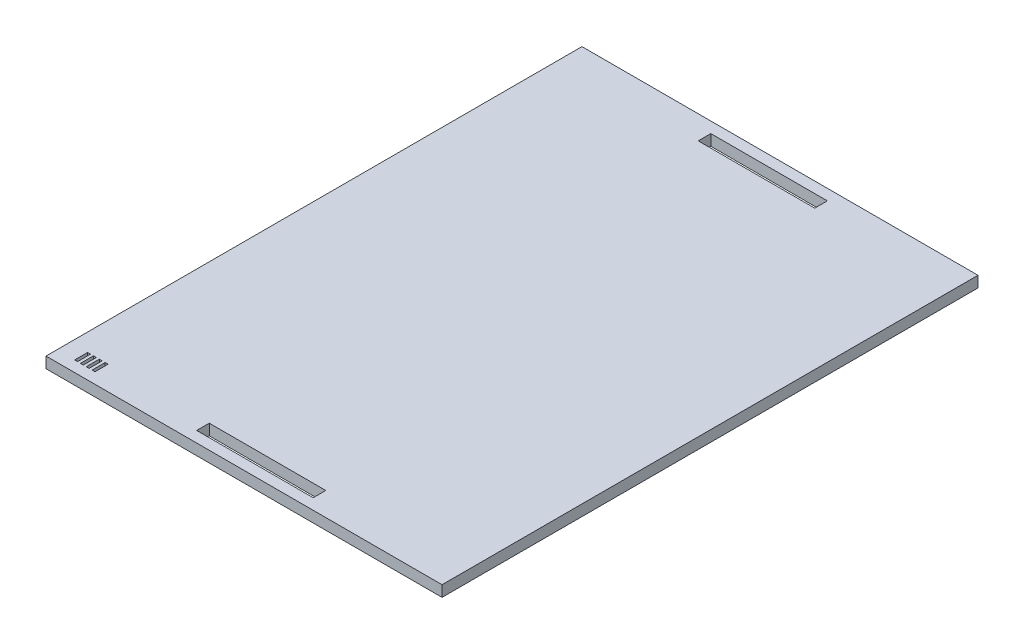
from build123d import *

# Parameters (mm, degrees)
SKETCH1_W           = 107.9246
SKETCH1_H           = 146.05
SKETCH1_W_2         = 31.75
SKETCH1_H_2         = 3.429
SKETCH1_W_3         = 0.79375
SKETCH1_H_3         = 3.556
BOSS_EXTRUDE1_DEPTH = 2.9972


with BuildPart() as part:
    # Sketch1 → Boss-Extrude1 (new body)
    with BuildSketch(Plane(origin=(0, 0, 0), x_dir=(1, 0, 0), z_dir=(0, 1, 0))):
        Rectangle(SKETCH1_W, SKETCH1_H)
        with Locations((0, 68.3387)):
            Rectangle(SKETCH1_W_2, SKETCH1_H_2, mode=Mode.SUBTRACT)
        with Locations((0, -68.3387)):
            Rectangle(SKETCH1_W_2, SKETCH1_H_2, mode=Mode.SUBTRACT)
        with Locations((-48.741664617, -68.2752)):
            Rectangle(SKETCH1_W_3, SKETCH1_H_3, mode=Mode.SUBTRACT)
        with Locations((-47.154164617, -68.2752)):
            Rectangle(SKETCH1_W_3, SKETCH1_H_3, mode=Mode.SUBTRACT)
        with Locations((-45.566664617, -68.2752)):
            Rectangle(SKETCH1_W_3, SKETCH1_H_3, mode=Mode.SUBTRACT)
        with Locations((-43.979164617, -68.2752)):
            Rectangle(SKETCH1_W_3, SKETCH1_H_3, mode=Mode.SUBTRACT)
    extrude(amount=BOSS_EXTRUDE1_DEPTH)


solid = part.part
